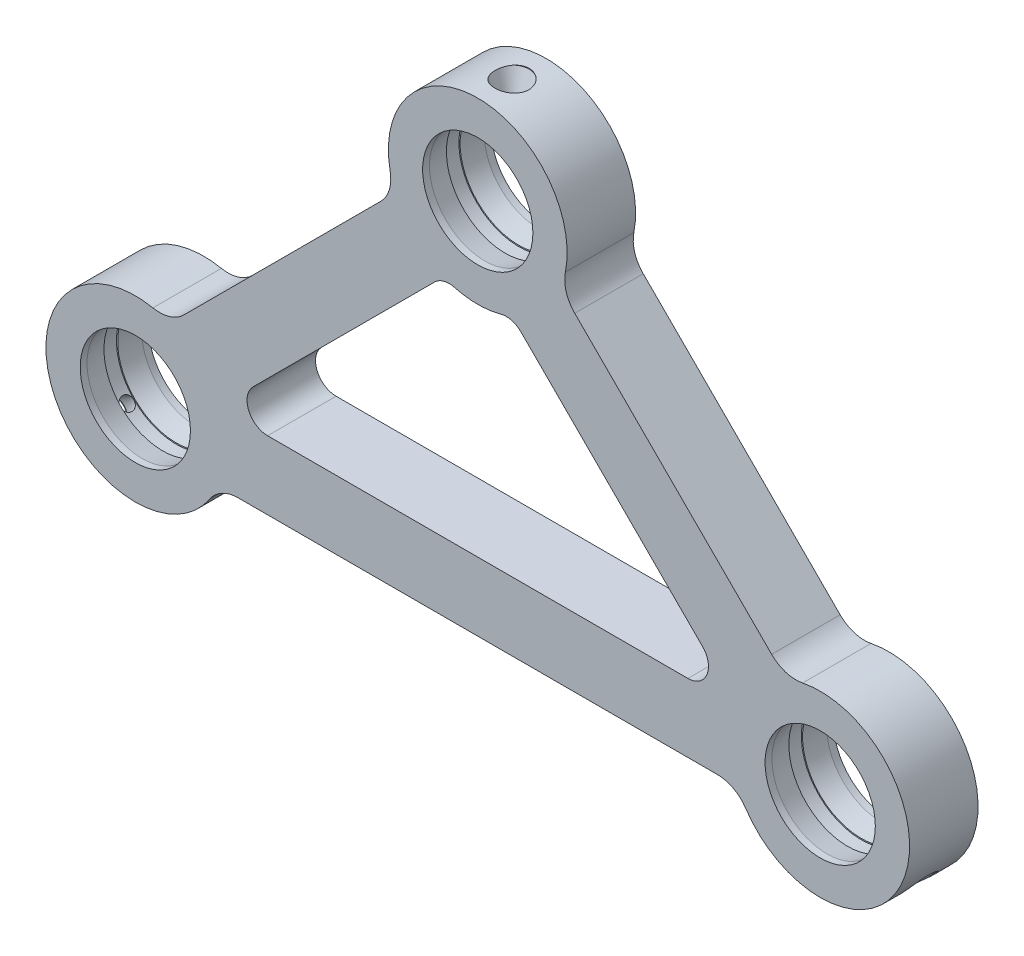
from build123d import *
from build123d.topology import SkipClean

# Parameters (mm, degrees)
SKETCH1_R                    = 8.05
BOSS_EXTRUDE1_DEPTH          = 8
CUT_EXTRUDE1_DEPTH           = 1
CUT_EXTRUDE1_DEPTH_BACK      = 1
SKETCH3_R                    = 8.755307923
SKETCH4_R                    = 2.5
CUT_EXTRUDE2_DEPTH           = 6
CUT_EXTRUDE2_TAPER           = 20
CUT_EXTRUDE2_OTHER_WAY_DEPTH = 10
FILLET1_R                    = 3
FILLET2_R                    = 5
SKETCH5_R                    = 2.5
CUT_EXTRUDE3_DEPTH           = 6
CUT_EXTRUDE3_TAPER           = 20
CUT_EXTRUDE3_OTHER_WAY_DEPTH = 10
DRAFT4_ANGLE                 = -10
DRAFT6_ANGLE                 = -10
SKETCH6_R                    = 2.5
CUT_EXTRUDE4_OTHER_WAY_DEPTH = 10
BOSS_EXTRUDE3_START          = 1
SKETCH7_R                    = 8.05
BOSS_EXTRUDE3_DEPTH          = 1
SKETCH11_R                   = 8.05
BOSS_EXTRUDE4_DEPTH          = 1


with BuildPart() as part:
    # Sketch1 → Boss-Extrude1 (new body)
    with BuildSketch(Plane.XY):
        with BuildLine():
            Line((11.402892275, 45.011963645), (-21.549967203, 12.059104167))
            ThreePointArc((-21.549967203, 12.059104167), (-38.594631457, -4.994018792), (-14.483854895, -5))
            Line((-14.483854895, -5), (61.407847779, -5))
            ThreePointArc((61.407847779, -5), (85.518624341, -4.994018792), (68.473960087, 12.059104167))
            Line((68.473960087, 12.059104167), (35.521100609, 45.011963645))
            ThreePointArc((35.521100609, 45.011963645), (23.461996442, 63.05), (11.402892275, 45.011963645))
        make_face()
        with BuildLine():
            Line((-14.466935746, 5), (18.473960087, 37.940895833))
            ThreePointArc((18.473960087, 37.940895833), (23.461996442, 36.95), (28.450032797, 37.940895833))
            Line((28.450032797, 37.940895833), (61.39092863, 5))
            Line((61.39092863, 5), (-14.466935746, 5))
        make_face(mode=Mode.SUBTRACT)
        with Locations((-26.538003558, 0)):
            Circle(SKETCH1_R, mode=Mode.SUBTRACT)
        with Locations((23.461996442, 50)):
            Circle(SKETCH1_R, mode=Mode.SUBTRACT)
        with Locations((73.461996442, 0)):
            Circle(SKETCH1_R, mode=Mode.SUBTRACT)
    extrude(amount=BOSS_EXTRUDE1_DEPTH)

    # Sketch3 → Cut-Extrude1 (cut, two sides: drawn at the far end of the back side and taken through both)
    with BuildSketch(Plane.XY.offset(4).offset(-CUT_EXTRUDE1_DEPTH_BACK)):
        with Locations((-26.538003558, 0)):
            Circle(SKETCH3_R)
        with Locations((23.461996442, 50)):
            Circle(SKETCH3_R)
        with Locations((73.461996442, 0)):
            Circle(SKETCH3_R)
    extrude(amount=CUT_EXTRUDE1_DEPTH + CUT_EXTRUDE1_DEPTH_BACK, mode=Mode.SUBTRACT)

    # Sketch4 → Cut-Extrude2 (cut)
    with BuildSketch(Plane(origin=(0, 62.95, 0), x_dir=(-1, 0, 0), z_dir=(0, -1, 0))):
        with Locations((-23.461996442, -4)):
            Circle(SKETCH4_R)
    extrude(amount=CUT_EXTRUDE2_DEPTH, taper=CUT_EXTRUDE2_TAPER, mode=Mode.SUBTRACT)

    # Sketch4 → Cut-Extrude2 other way (cut)
    with BuildSketch(Plane(origin=(0, 62.95, 0), x_dir=(-1, 0, 0), z_dir=(0, -1, 0))):
        with Locations((-23.461996442, -4)):
            Circle(SKETCH4_R)
    extrude(amount=-CUT_EXTRUDE2_OTHER_WAY_DEPTH, mode=Mode.SUBTRACT)

    # Fillet1
    fillet1_edges = [part.edges().sort_by_distance(p)[0] for p in [
        (-14.466935746, 5, 4),
        (18.473960087, 37.940895833, 4),
        (28.450032797, 37.940895833, 4),
        (61.39092863, 5, 4),
    ]]
    fillet(fillet1_edges, radius=FILLET1_R)

    # Fillet2
    fillet2_edges = [part.edges().sort_by_distance(p)[0] for p in [
        (68.473960087, 12.059104167, 4),
        (35.521100609, 45.011963645, 4),
        (11.402892275, 45.011963645, 4),
        (-21.549967203, 12.059104167, 4),
        (-14.483854895, -5, 4),
        (61.407847779, -5, 4),
    ]]
    fillet(fillet2_edges, radius=FILLET2_R)

    # Sketch5 → Cut-Extrude3 (cut)
    with BuildSketch(Plane(origin=(45.888031037, -45.888031037, 0), x_dir=(0, 0, 1), z_dir=(-0.7071067811865489, 0.7071067811865462, 0))):
        with Locations((4, 51.945475844)):
            Circle(SKETCH5_R)
    extrude(amount=CUT_EXTRUDE3_DEPTH, taper=CUT_EXTRUDE3_TAPER, mode=Mode.SUBTRACT)

    # Sketch5 → Cut-Extrude3 other way (cut)
    with BuildSketch(Plane(origin=(45.888031037, -45.888031037, 0), x_dir=(0, 0, 1), z_dir=(-0.7071067811865489, 0.7071067811865462, 0))):
        with Locations((4, 51.945475844)):
            Circle(SKETCH5_R)
    extrude(amount=-CUT_EXTRUDE3_OTHER_WAY_DEPTH, mode=Mode.SUBTRACT)

    # Draft4
    draft4_faces = [part.faces().sort_by_distance(p)[0] for p in [
        (-34.588003558, 0, 6.5),
        (15.411996442, 50, 6.5),
        (65.411996442, 0, 6.5),
    ]]
    draft(draft4_faces, Plane.XY.offset(8), DRAFT4_ANGLE)

    # Draft6
    draft6_faces = [part.faces().sort_by_distance(p)[0] for p in [
        (-34.588003558, 0, 1.5),
        (65.411996442, 0, 1.5),
        (15.411996442, 50, 1.5),
    ]]
    draft(draft6_faces, Plane(origin=(0, 0, 0), x_dir=(-1, 0, 0), z_dir=(0, 0, -1)), DRAFT6_ANGLE)

    # Cut-Extrude4 cone 1 section (through the dimple's axis) → Cut-Extrude4 (revolve, cut)
    with BuildSketch(Plane(origin=(-35.695036374, -9.157032816, 4), x_dir=(0, 0, -1), z_dir=(0.707106781, -0.707106781, 0))):
        Polygon((0, 0), (2.5, 0), (0, 6.868693549), align=None)
    revolve(axis=Axis((-35.695036374, -9.157032816, 4), (0.707106781, 0.707106781, 0)), mode=Mode.SUBTRACT)

    # Sketch6 → Cut-Extrude4 other way (cut)
    with BuildSketch(Plane(origin=(-22.426034595, -22.426034595, 0), x_dir=(0, 0, -1), z_dir=(0.7071067811865486, 0.7071067811865465, 0))):
        with Locations((-4, 18.765202275)):
            Circle(SKETCH6_R)
    extrude(amount=-CUT_EXTRUDE4_OTHER_WAY_DEPTH, mode=Mode.SUBTRACT)

    # Sketch7 → Boss-Extrude3 (add)
    with BuildSketch(Plane.XY.offset(8).offset(BOSS_EXTRUDE3_START)):
        with BuildLine():
            Line((66.37203036, 14.161033894), (37.623030336, 42.910033918))
            ThreePointArc((37.623030336, 42.910033918), (36.372509491, 44.998612426), (36.256467899, 47.430175075))
            ThreePointArc((36.256467899, 47.430175075), (23.461996442, 63.05), (10.667524985, 47.430175075))
            ThreePointArc((10.667524985, 47.430175075), (10.551483393, 44.998612426), (9.300962548, 42.910033918))
            Line((9.300962548, 42.910033918), (-19.448037476, 14.161033894))
            ThreePointArc((-19.448037476, 14.161033894), (-21.536615984, 12.910513049), (-23.968178633, 12.794471457))
            ThreePointArc((-23.968178633, 12.794471457), (-38.594631457, -4.994018792), (-15.673805398, -7.229916898))
            ThreePointArc((-15.673805398, -7.229916898), (-13.872377163, -5.592596257), (-11.511277368, -5))
            Line((-11.511277368, -5), (58.435270252, -5))
            ThreePointArc((58.435270252, -5), (60.796370047, -5.592596257), (62.597798282, -7.229916898))
            ThreePointArc((62.597798282, -7.229916898), (85.518624341, -4.994018792), (70.892171517, 12.794471457))
            ThreePointArc((70.892171517, 12.794471457), (68.460608868, 12.910513049), (66.37203036, 14.161033894))
        make_face()
        with Locations((-26.538003558, 0)):
            Circle(SKETCH7_R, mode=Mode.SUBTRACT)
        with Locations((73.461996442, 0)):
            Circle(SKETCH7_R, mode=Mode.SUBTRACT)
        with Locations((23.461996442, 50)):
            Circle(SKETCH7_R, mode=Mode.SUBTRACT)
        with BuildLine():
            Line((-7.224295059, 5), (54.148287943, 5))
            ThreePointArc((54.148287943, 5), (56.919926541, 6.851949703), (56.269608287, 10.121320344))
            Line((56.269608287, 10.121320344), (29.765225162, 36.625703469))
            ThreePointArc((29.765225162, 36.625703469), (28.41775702, 37.402857339), (26.862239701, 37.400760111))
            ThreePointArc((26.862239701, 37.400760111), (23.461996442, 36.95), (20.061753183, 37.400760111))
            ThreePointArc((20.061753183, 37.400760111), (18.506235864, 37.402857339), (17.158767722, 36.625703469))
            Line((17.158767722, 36.625703469), (-9.345615403, 10.121320344))
            ThreePointArc((-9.345615403, 10.121320344), (-9.995933657, 6.851949703), (-7.224295059, 5))
        make_face(mode=Mode.SUBTRACT)
    extrude(amount=-BOSS_EXTRUDE3_DEPTH)

    # Sketch11 → Boss-Extrude4 (add)
    with SkipClean():  # the faces are left unmerged after this step: merging them gives an invalid solid
        with BuildSketch(Plane(origin=(0, 0, 0), x_dir=(-1, 0, 0), z_dir=(0, 0, -1))):
            with BuildLine():
                Line((-37.623030336, 42.910033918), (-66.37203036, 14.161033894))
                ThreePointArc((-66.37203036, 14.161033894), (-68.460608868, 12.910513049), (-70.892171517, 12.794471457))
                ThreePointArc((-70.892171517, 12.794471457), (-85.518624341, -4.994018792), (-62.597798282, -7.229916898))
                ThreePointArc((-62.597798282, -7.229916898), (-60.796370047, -5.592596257), (-58.435270252, -5))
                Line((-58.435270252, -5), (11.511277368, -5))
                ThreePointArc((11.511277368, -5), (13.872377163, -5.592596257), (15.673805398, -7.229916898))
                ThreePointArc((15.673805398, -7.229916898), (38.594631457, -4.994018792), (23.968178633, 12.794471457))
                ThreePointArc((23.968178633, 12.794471457), (21.536615984, 12.910513049), (19.448037476, 14.161033894))
                Line((19.448037476, 14.161033894), (-9.300962548, 42.910033918))
                ThreePointArc((-9.300962548, 42.910033918), (-10.551483393, 44.998612426), (-10.667524985, 47.430175075))
                ThreePointArc((-10.667524985, 47.430175075), (-23.461996442, 63.05), (-36.256467899, 47.430175075))
                ThreePointArc((-36.256467899, 47.430175075), (-36.372509491, 44.998612426), (-37.623030336, 42.910033918))
            make_face()
            with Locations((-73.461996442, 0)):
                Circle(SKETCH11_R, mode=Mode.SUBTRACT)
            with Locations((-23.461996442, 50)):
                Circle(SKETCH11_R, mode=Mode.SUBTRACT)
            with Locations((26.538003558, 0)):
                Circle(SKETCH11_R, mode=Mode.SUBTRACT)
            with BuildLine():
                Line((-17.158767722, 36.625703469), (9.345615403, 10.121320344))
                ThreePointArc((9.345615403, 10.121320344), (9.995933657, 6.851949703), (7.224295059, 5))
                Line((7.224295059, 5), (-54.148287943, 5))
                ThreePointArc((-54.148287943, 5), (-56.919926541, 6.851949703), (-56.269608287, 10.121320344))
                Line((-56.269608287, 10.121320344), (-29.765225162, 36.625703469))
                ThreePointArc((-29.765225162, 36.625703469), (-28.41775702, 37.402857339), (-26.862239701, 37.400760111))
                ThreePointArc((-26.862239701, 37.400760111), (-23.461996442, 36.95), (-20.061753183, 37.400760111))
                ThreePointArc((-20.061753183, 37.400760111), (-18.506235864, 37.402857339), (-17.158767722, 36.625703469))
            make_face(mode=Mode.SUBTRACT)
        extrude(amount=BOSS_EXTRUDE4_DEPTH)


solid = part.part
